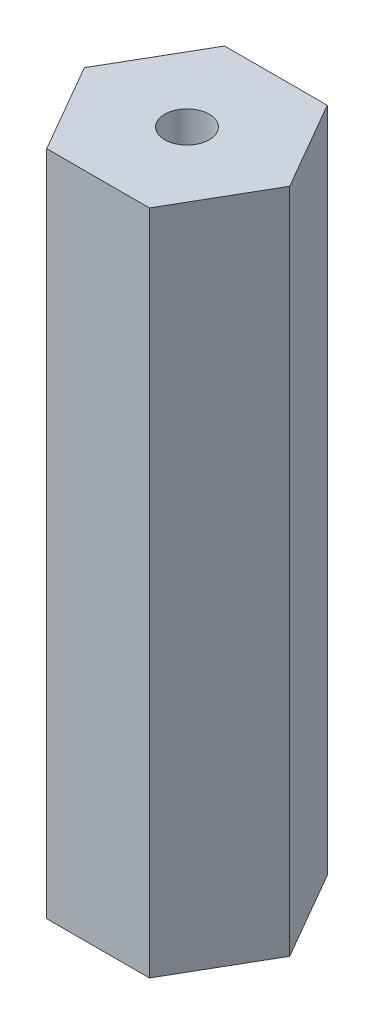
from build123d import *

# Parameters (mm, degrees)
BOSS_EXTRUDE1_DEPTH = 47.625
SKETCH2_R           = 3.175
CUT_EXTRUDE1_DEPTH  = 98.205482527


with BuildPart() as part:
    # Sketch1 → Boss-Extrude1 (new, symmetric)
    with BuildSketch(Plane(origin=(0, 0, 0), x_dir=(1, 0, 0), z_dir=(0, 1, 0))):
        Polygon((-14.664696837, 0), (-7.332348419, -12.7), (7.332348419, -12.7), (14.664696837, 0), (7.332348419, 12.7), (-7.332348419, 12.7), align=None)
    extrude(amount=BOSS_EXTRUDE1_DEPTH, both=True)

    # Sketch2 → Cut-Extrude1 (cut, through all)
    with BuildSketch(Plane(origin=(0, 47.625, 0), x_dir=(1, 0, 0), z_dir=(0, 1, 0))):
        with Locations(Location((0, 0, 0), (0, 0, 270))):
            Circle(SKETCH2_R)
    extrude(amount=-CUT_EXTRUDE1_DEPTH, mode=Mode.SUBTRACT)


solid = part.part
